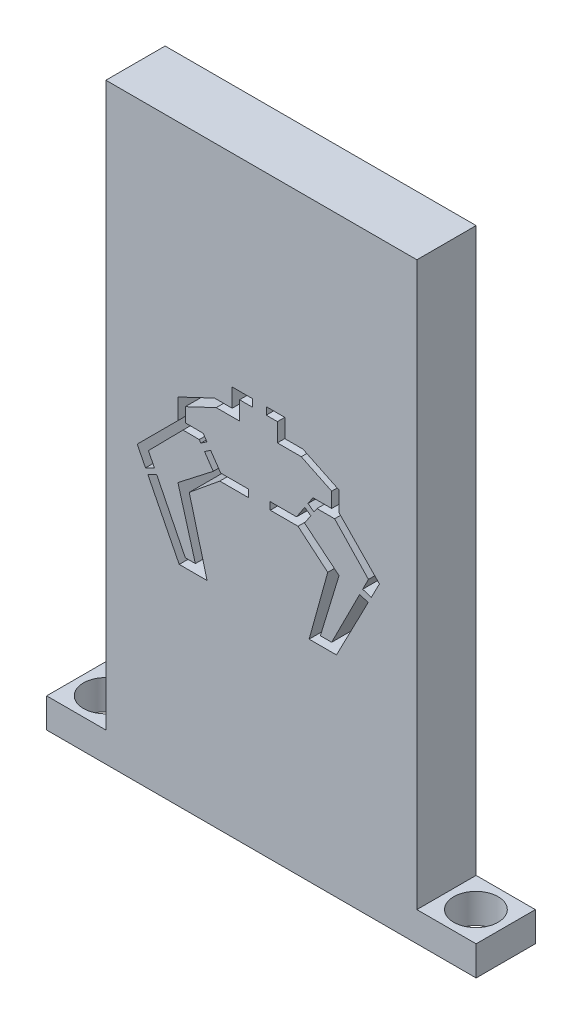
from build123d import *

# Parameters (mm, degrees)
SKETCH1_W               = 29
SKETCH1_H               = 4
SKETCH1_R               = 1.5
BOSS_EXTRUDE1_DEPTH     = 2
SKETCH1_3_W             = 21
SKETCH1_3_H             = 4
BOSS_EXTRUDE2_DEPTH     = 40
CUT_EXTRUDE1_DEPTH      = 50.568134926
CUT_EXTRUDE1_DEPTH_BACK = 50.568134926


with BuildPart() as part:
    # Sketch1 → Boss-Extrude1 (new body)
    with BuildSketch(Plane(origin=(0, 0, 0), x_dir=(1, 0, 0), z_dir=(0, 1, 0))):
        with Locations((14.5, 2)):
            Rectangle(SKETCH1_W, SKETCH1_H)
        with Locations((1.985523286, 2)):
            Circle(SKETCH1_R, mode=Mode.SUBTRACT)
        with Locations((26.985523286, 2)):
            Circle(SKETCH1_R, mode=Mode.SUBTRACT)
    extrude(amount=BOSS_EXTRUDE1_DEPTH)

    # Sketch1<3> → Boss-Extrude2 (add)
    with BuildSketch(Plane(origin=(0, 0, 0), x_dir=(1, 0, 0), z_dir=(0, 1, 0))):
        with Locations((14.5, 2)):
            Rectangle(SKETCH1_3_W, SKETCH1_3_H)
    extrude(amount=BOSS_EXTRUDE2_DEPTH)

    # Sketch4 → Cut-Extrude1 (cut, two sides: drawn at the far end of the back side and taken through both)
    with BuildSketch(Plane.XY.offset(-CUT_EXTRUDE1_DEPTH_BACK)):
        Polygon((14.829784235, 25.826592436), (15.580318165, 25.826592436), (15.580318165, 24.58059841), (17.192781023, 24.58059841), (19.245006478, 23.591132565), (19.245006478, 22.577235465), (17.982823566, 22.577235465), (17.650133225, 22.074575332), (18.051844448, 21.775593359), (18.251489115, 22.077235465), (19.444594864, 22.077235465), (21.728896307, 19.673543908), (21.340089812, 18.903582673), (21.919881884, 18.713869931), (22.47100439, 19.777672119), (19.745006478, 22.577235465), (19.745006478, 23.905142602), (17.307024063, 25.08059841), (16.080318165, 25.08059841), (16.080318165, 26.326592436), (14.829784235, 26.326592436), align=None)
        Polygon((13.027251973, 25.826592436), (13.917191226, 25.826592436), (13.917191226, 26.326592436), (12.527251973, 26.326592436), (12.527251973, 25.08059841), (11.339002885, 25.08059841), (8.862563659, 23.907548251), (8.862563659, 22.524621534), (6.115614244, 19.777672119), (6.67527171, 18.669699411), (7.27342553, 18.971837946), (6.874226368, 19.777672119), (9.208768581, 22.14696034), (10.304123515, 22.13906148), (10.411216966, 21.982171939), (10.824179507, 22.264061881), (10.56950065, 22.637160784), (9.362563659, 22.645864288), (9.362563659, 23.591132565), (11.451435998, 24.58059841), (13.027251973, 24.58059841), align=None)
        Polygon((17.834770022, 21.447616721), (17.428999134, 21.740464967), (16.875174702, 20.903694469), (15.097594277, 20.903694469), (15.097594277, 20.403694469), (16.97171728, 20.403694469), (18.980777312, 18.713869931), (17.724730843, 14.177305917), (19.569630531, 14.177305917), (21.712038769, 18.312681525), (21.136756911, 18.500918487), (19.245006478, 14.754647487), (18.482173443, 14.754647487), (19.745006478, 18.903582673), (17.415142863, 20.813604196), align=None)
        Polygon((11.752771943, 20.903694469), (11.07591062, 21.895281359), (10.662948079, 21.613391417), (11.249689352, 20.753828409), (8.862563659, 18.903582673), (10.041604324, 14.754647487), (9.362563659, 14.754647487), (7.428562862, 18.658673552), (6.830494871, 18.362398898), (8.952818152, 14.16076412), (10.833448813, 14.16076412), (9.629185319, 18.713869931), (11.691280342, 20.403694469), (13.634288417, 20.403694469), (13.634288417, 20.903694469), align=None)
    extrude(amount=CUT_EXTRUDE1_DEPTH + CUT_EXTRUDE1_DEPTH_BACK, mode=Mode.SUBTRACT)


solid = part.part
